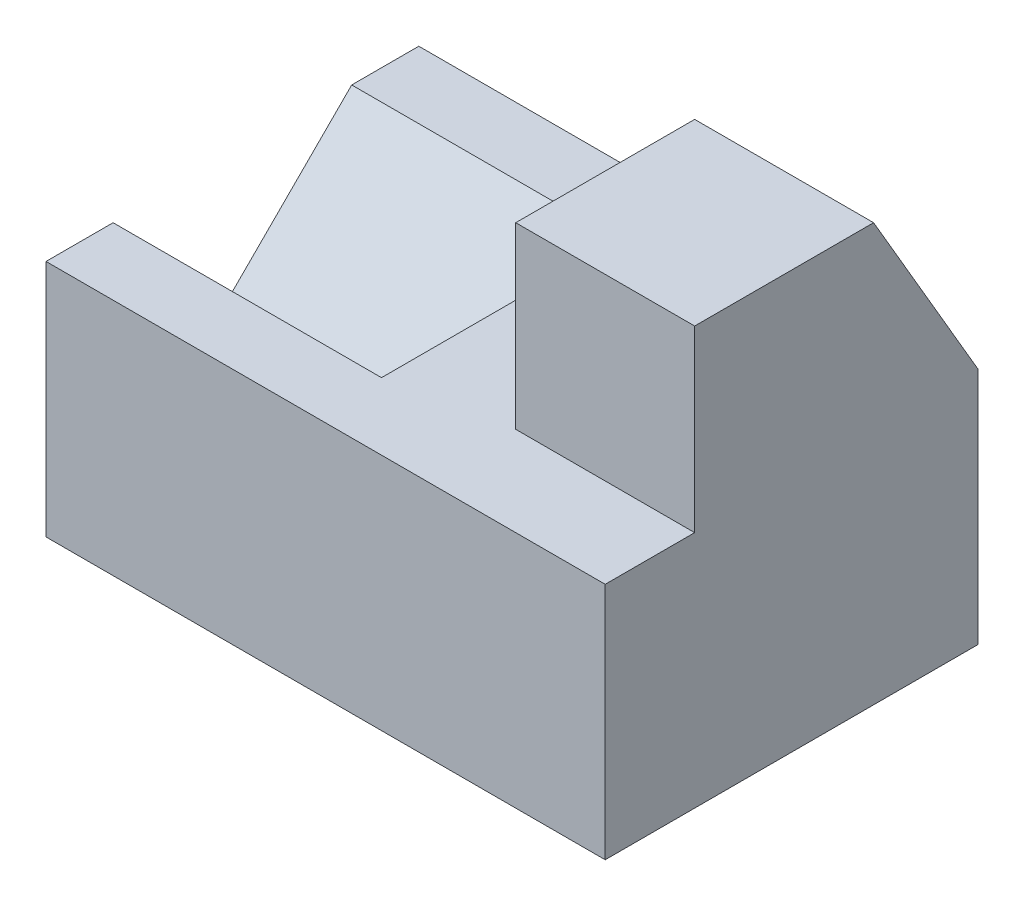
from build123d import *

# Parameters (mm, degrees)
BOSS_EXTRUDE1_DEPTH = 75
BOSS_EXTRUDE2_DEPTH = 24
CUT_EXTRUDE1_DEPTH  = 36


with BuildPart() as part:
    # Sketch1 → Boss-Extrude1 (new body)
    with BuildSketch(Plane(origin=(0, 0, 0), x_dir=(0, 0, -1), z_dir=(1, 0, 0))):
        Polygon((25, -16), (25, 16), (-13, 16), (-25, 16), (-25, -16), align=None)
    extrude(amount=-BOSS_EXTRUDE1_DEPTH)

    # Sketch1<3> → Boss-Extrude2 (add)
    with BuildSketch(Plane(origin=(0, 0, 0), x_dir=(0, 0, -1), z_dir=(1, 0, 0))):
        Polygon((-13, 16), (25, 16), (11, 40), (-13, 40), align=None)
    extrude(amount=-BOSS_EXTRUDE2_DEPTH)

    # Sketch2 → Cut-Extrude1 (cut)
    with BuildSketch(Plane.ZY.offset(75)):
        Polygon((-16, 16), (0, 0), (16, 16), align=None)
    extrude(amount=-CUT_EXTRUDE1_DEPTH, mode=Mode.SUBTRACT)


solid = part.part
